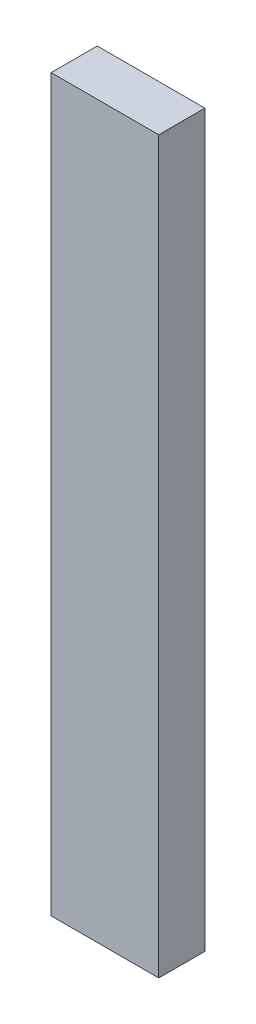
from build123d import *

# Parameters (mm, degrees)
SKETCH1_W           = 88.9
SKETCH1_H           = 38.1
BOSS_EXTRUDE1_DEPTH = 603.25


with BuildPart() as part:
    # Sketch1 → Boss-Extrude1 (new body)
    with BuildSketch(Plane(origin=(0, 0, 0), x_dir=(1, 0, 0), z_dir=(0, 1, 0))):
        Rectangle(SKETCH1_W, SKETCH1_H)
    extrude(amount=BOSS_EXTRUDE1_DEPTH)


solid = part.part
